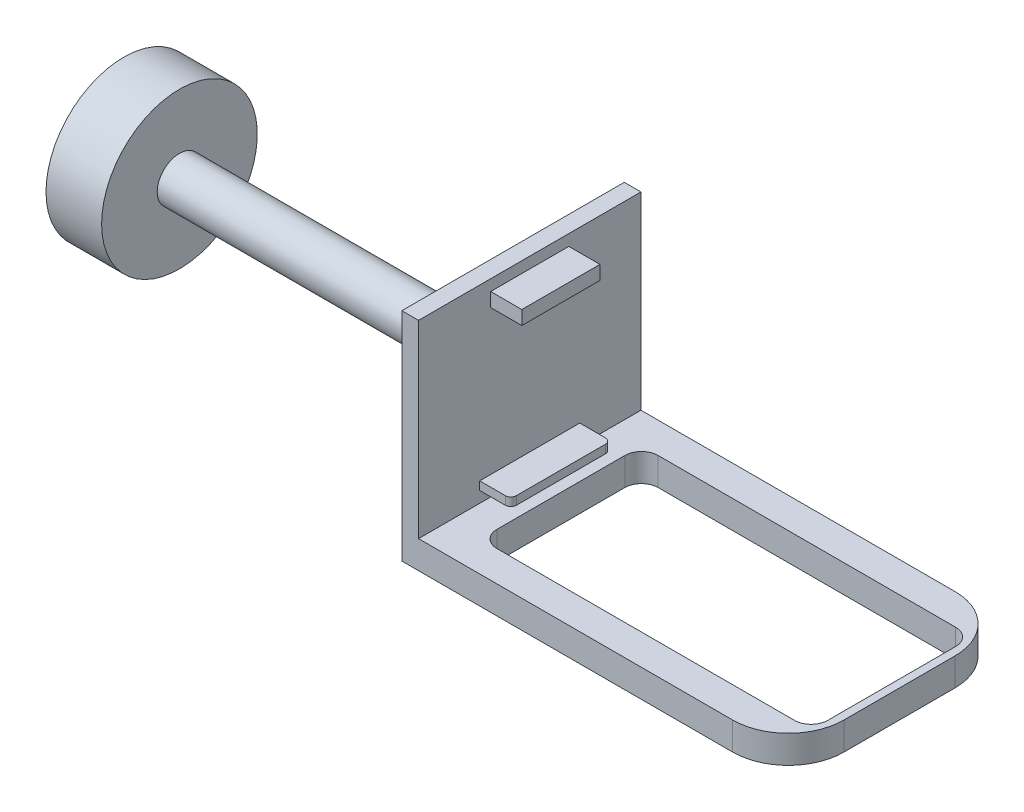
from build123d import *

# Parameters (mm, degrees)
SKETCH2_W           = 66.5
SKETCH2_H           = 40
BOSS_EXTRUDE1_DEPTH = 5
SKETCH5_W           = 40
SKETCH5_H           = 39
BOSS_EXTRUDE3_DEPTH = 3
SKETCH11_W          = 14.05
SKETCH11_H          = 2.5
SKETCH11_W_2        = 18
SKETCH11_H_2        = 1.5
BOSS_EXTRUDE4_DEPTH = 5.6
FILLET4_R           = 1
SKETCH12_R          = 4
BOSS_EXTRUDE5_DEPTH = 60
FILLET6_R           = 10
SKETCH13_R          = 14
BOSS_EXTRUDE6_DEPTH = 10
SKETCH14_R          = 5
CUT_EXTRUDE1_DEPTH  = 5
SKETCH15_R          = 2.25
CUT_EXTRUDE2_DEPTH  = 3


with BuildPart() as part:
    # Sketch2 → Boss-Extrude1 (new body)
    with BuildSketch(Plane(origin=(0, 0, 0), x_dir=(1, 0, 0), z_dir=(0, 1, 0))):
        Rectangle(SKETCH2_W, SKETCH2_H)
        with BuildLine():
            Line((-27.65, 11.5), (-27.65, -11.5))
            ThreePointArc((-27.65, -11.5), (-26.771320344, -13.621320344), (-24.65, -14.5))
            Line((-24.65, -14.5), (28.85, -14.5))
            ThreePointArc((28.85, -14.5), (30.971320344, -13.621320344), (31.85, -11.5))
            Line((31.85, -11.5), (31.85, 11.5))
            ThreePointArc((31.85, 11.5), (30.971320344, 13.621320344), (28.85, 14.5))
            Line((28.85, 14.5), (-24.65, 14.5))
            ThreePointArc((-24.65, 14.5), (-26.771320344, 13.621320344), (-27.65, 11.5))
        make_face(mode=Mode.SUBTRACT)
    extrude(amount=BOSS_EXTRUDE1_DEPTH)

    # Sketch5 → Boss-Extrude3 (add)
    with BuildSketch(Plane.ZY.offset(33.25)):
        with Locations((0, 19.5)):
            Rectangle(SKETCH5_W, SKETCH5_H)
    extrude(amount=BOSS_EXTRUDE3_DEPTH)

    # Sketch11 → Boss-Extrude4 (add)
    with BuildSketch(Plane(origin=(-33.25, 0, 0), x_dir=(0, 0, -1), z_dir=(1, 0, 0))):
        with Locations((0, 35.75)):
            Rectangle(SKETCH11_W, SKETCH11_H)
        with Locations((0, 7.75)):
            Rectangle(SKETCH11_W_2, SKETCH11_H_2)
    extrude(amount=BOSS_EXTRUDE4_DEPTH)

    # Fillet4
    fillet4_edges = [part.edges().sort_by_distance(p)[0] for p in [
        (-27.65, 7.75, -9),
        (-27.65, 7.75, 9),
    ]]
    fillet(fillet4_edges, radius=FILLET4_R)

    # Sketch12 → Boss-Extrude5 (add)
    with BuildSketch(Plane.ZY.offset(36.25)):
        with Locations((0, 19.5)):
            Circle(SKETCH12_R)
    extrude(amount=BOSS_EXTRUDE5_DEPTH)

    # Fillet6
    fillet6_edges = [part.edges().sort_by_distance(p)[0] for p in [
        (33.25, 2.5, 20),
        (33.25, 2.5, -20),
    ]]
    fillet(fillet6_edges, radius=FILLET6_R)

    # Sketch13 → Boss-Extrude6 (add)
    with BuildSketch(Plane.ZY.offset(96.25)):
        with Locations((0, 19.5)):
            Circle(SKETCH13_R)
    extrude(amount=BOSS_EXTRUDE6_DEPTH)

    # Sketch14 → Cut-Extrude1 (cut)
    with BuildSketch(Plane.ZY.offset(106.25)):
        with Locations((0, 19.5)):
            Circle(SKETCH14_R)
    extrude(amount=-CUT_EXTRUDE1_DEPTH, mode=Mode.SUBTRACT)

    # Sketch15 → Cut-Extrude2 (cut)
    with BuildSketch(Plane.ZY.offset(101.25)):
        with Locations((0, 19.5)):
            Circle(SKETCH15_R)
    extrude(amount=-CUT_EXTRUDE2_DEPTH, mode=Mode.SUBTRACT)


solid = part.part
